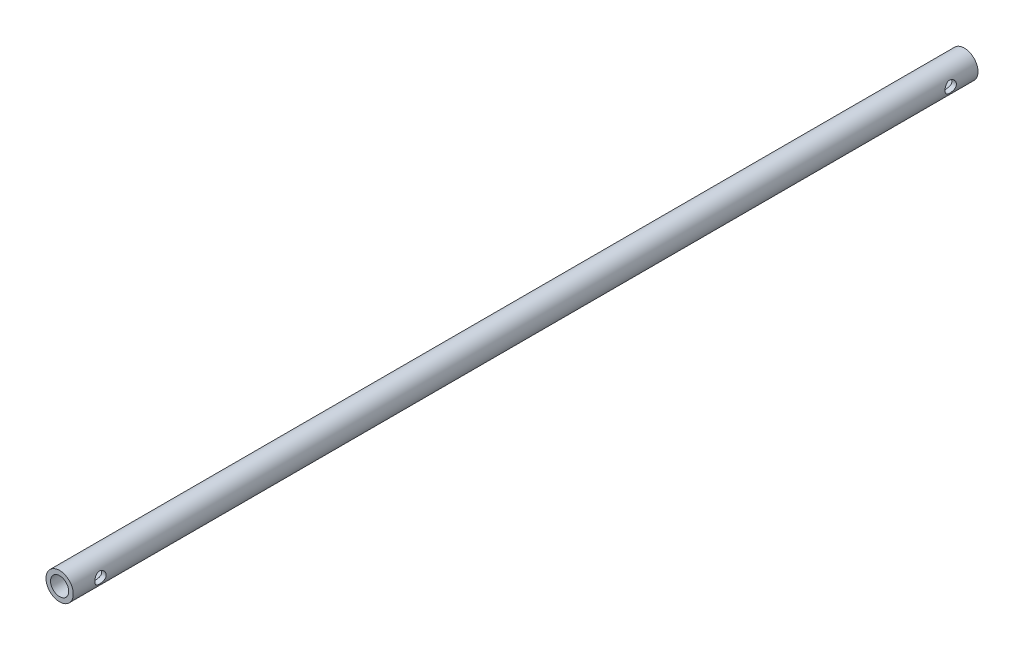
from build123d import *

# Parameters (mm, degrees)
ESQUISSE1_R                  = 3
ESQUISSE1_R_2                = 2
BOSS_EXTRU_1_DEPTH           = 199
ENL_V_MAT_EXTRU_1_DEPTH      = 200.045220993
ENL_V_MAT_EXTRU_1_DEPTH_BACK = 200.045220993
ESQUISSE2_R                  = 1.25


with BuildPart() as part:
    # Esquisse1 → Boss.-Extru.1 (new body)
    with BuildSketch(Plane.XY):
        Circle(ESQUISSE1_R)
        Circle(ESQUISSE1_R_2, mode=Mode.SUBTRACT)
    extrude(amount=BOSS_EXTRU_1_DEPTH)

    # Esquisse2 → Enlèv. mat.-Extru.1 (cut, two sides: drawn at the far end of the back side and taken through both)
    with BuildSketch(Plane(origin=(0, 0, 0), x_dir=(0, 0, -1), z_dir=(1, 0, 0)).offset(-ENL_V_MAT_EXTRU_1_DEPTH_BACK)):
        with Locations((-6, 0)):
            Circle(ESQUISSE2_R)
        with Locations((-193, 0)):
            Circle(ESQUISSE2_R)
    extrude(amount=ENL_V_MAT_EXTRU_1_DEPTH + ENL_V_MAT_EXTRU_1_DEPTH_BACK, mode=Mode.SUBTRACT)


solid = part.part
